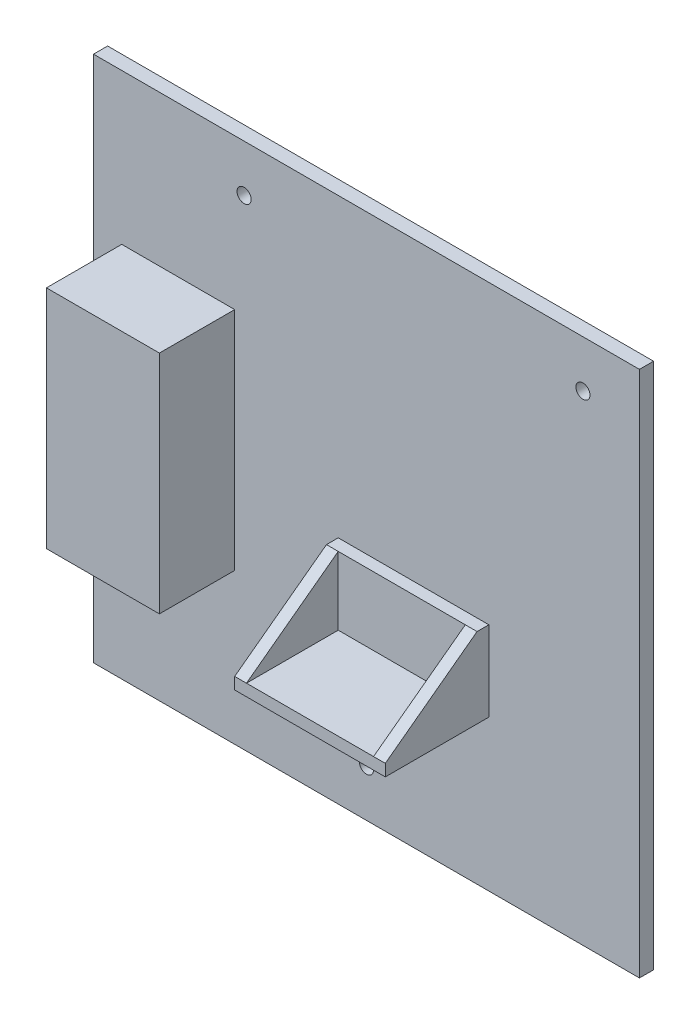
from build123d import *

# Parameters (mm, degrees)
SKETCH1_W           = 116
SKETCH1_H           = 112
BOSS_EXTRUDE1_DEPTH = 3
SKETCH2_W           = 24
SKETCH2_H           = 48
BOSS_EXTRUDE2_DEPTH = 16
SKETCH3_W           = 32
SKETCH3_H           = 17
BOSS_EXTRUDE3_DEPTH = 22
CUT_EXTRUDE1_REACH  = 106.005
SKETCH5_W           = 27
SKETCH5_H           = 14.5
CUT_EXTRUDE2_DEPTH  = 19.5
CUT_EXTRUDE3_REACH  = 85.57
SKETCH6_R           = 1.5


with BuildPart() as part:
    # Sketch1 → Boss-Extrude1 (new body)
    with BuildSketch(Plane.XY):
        Rectangle(SKETCH1_W, SKETCH1_H)
    extrude(amount=BOSS_EXTRUDE1_DEPTH)

    # Sketch2 → Boss-Extrude2 (add)
    with BuildSketch(Plane.XY.offset(3)):
        with Locations((-40, 0)):
            Rectangle(SKETCH2_W, SKETCH2_H)
    extrude(amount=BOSS_EXTRUDE2_DEPTH)

    # Sketch3 → Boss-Extrude3 (add)
    with BuildSketch(Plane.XY.offset(3)):
        with Locations((10, -15.5)):
            Rectangle(SKETCH3_W, SKETCH3_H)
    extrude(amount=BOSS_EXTRUDE3_DEPTH)

    # Sketch4 → Cut-Extrude1 (cut, up to next)
    with BuildSketch(Plane(origin=(26, 0, 0), x_dir=(0, 0, -1), z_dir=(1, 0, 0)), mode=Mode.PRIVATE) as cut_extrude1_sk1:
        Polygon((-25, -21.5), (-5.5, -7), (-25, -7), align=None)
    cut_extrude1_tool1 = extrude(cut_extrude1_sk1.sketch, amount=-CUT_EXTRUDE1_REACH, mode=Mode.PRIVATE) & part.part
    add(cut_extrude1_tool1.solids().sort_by_distance((26, -11.833333, 18.5))[0], mode=Mode.SUBTRACT)

    # Sketch5 → Cut-Extrude2 (cut)
    with BuildSketch(Plane.XY.offset(25)):
        with Locations((10, -14.25)):
            Rectangle(SKETCH5_W, SKETCH5_H)
    extrude(amount=-CUT_EXTRUDE2_DEPTH, mode=Mode.SUBTRACT)

    # Sketch6 → Cut-Extrude3 (cut, up to next)
    with BuildSketch(Plane.XY.offset(3), mode=Mode.PRIVATE) as cut_extrude3_sk1:
        with Locations((-26, 46)):
            Circle(SKETCH6_R)
    cut_extrude3_tool1 = extrude(cut_extrude3_sk1.sketch, amount=-CUT_EXTRUDE3_REACH, mode=Mode.PRIVATE) & part.part
    # Sketch6 → Cut-Extrude3 (cut, up to next)
    with BuildSketch(Plane.XY.offset(3), mode=Mode.PRIVATE) as cut_extrude3_sk2:
        with Locations((46, 46)):
            Circle(SKETCH6_R)
    cut_extrude3_tool2 = extrude(cut_extrude3_sk2.sketch, amount=-CUT_EXTRUDE3_REACH, mode=Mode.PRIVATE) & part.part
    # Sketch6 → Cut-Extrude3 (cut, up to next)
    with BuildSketch(Plane.XY.offset(3), mode=Mode.PRIVATE) as cut_extrude3_sk3:
        with Locations((0, -46)):
            Circle(SKETCH6_R)
    cut_extrude3_tool3 = extrude(cut_extrude3_sk3.sketch, amount=-CUT_EXTRUDE3_REACH, mode=Mode.PRIVATE) & part.part
    add(cut_extrude3_tool1.solids().sort_by_distance((-26, 46, 3))[0], mode=Mode.SUBTRACT)
    add(cut_extrude3_tool2.solids().sort_by_distance((46, 46, 3))[0], mode=Mode.SUBTRACT)
    add(cut_extrude3_tool3.solids().sort_by_distance((0, -46, 3))[0], mode=Mode.SUBTRACT)


solid = part.part
